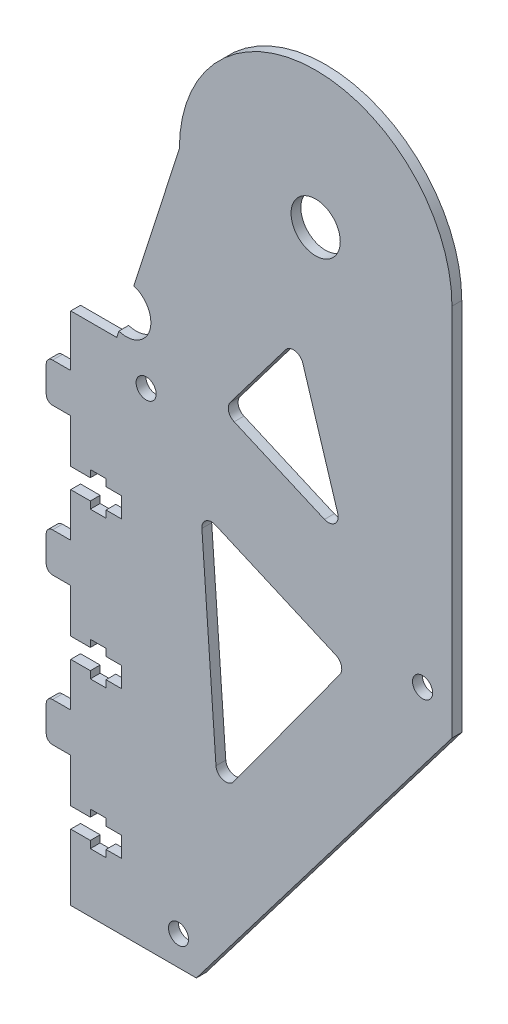
from build123d import *

# Parameters (mm, degrees)
SKETCH_1_R          = 5.0225
SKETCH_1_R_2        = 2.05
EXTRUDE_1_DEPTH     = 2
FILLET_1_R          = 2
FILLET_2_R          = 1.3
SKETCH_3_R          = 5
CUT_EXTRUDE_1_DEPTH = 2


with BuildPart() as part:
    # 草图1 → 凸台-拉伸1 (new body)
    with BuildSketch(Plane.XY):
        with BuildLine():
            Line((298.545628784, -83.894391363), (298.545628784, -92.841778663))
            Line((298.545628784, -92.841778663), (302.545628784, -92.841778663))
            Line((302.545628784, -92.841778663), (302.545628784, -91.391778663))
            Line((302.545628784, -91.391778663), (305.745628784, -91.391778663))
            Line((305.745628784, -91.391778663), (305.745628784, -92.841778663))
            Line((305.745628784, -92.841778663), (308.945628784, -92.841778663))
            Line((308.945628784, -92.841778663), (308.945628784, -96.941778663))
            Line((308.945628784, -96.941778663), (305.745628784, -96.941778663))
            Line((305.745628784, -96.941778663), (305.745628784, -98.391778663))
            Line((305.745628784, -98.391778663), (302.545628784, -98.391778663))
            Line((302.545628784, -98.391778663), (302.545628784, -96.941778663))
            Line((302.545628784, -96.941778663), (298.545628784, -96.941778663))
            Line((298.545628784, -96.941778663), (298.545628784, -105.894391358))
            Line((298.545628784, -105.894391358), (293.545628784, -105.894391358))
            Line((293.545628784, -105.894391358), (293.545628784, -113.894391358))
            Line((293.545628784, -113.894391358), (298.545628784, -113.894391358))
            Line((298.545628784, -113.894391358), (298.545628784, -122.847004054))
            Line((298.545628784, -122.847004054), (302.545628784, -122.847004054))
            Line((302.545628784, -122.847004054), (302.545628784, -121.397004054))
            Line((302.545628784, -121.397004054), (305.745628784, -121.397004054))
            Line((305.745628784, -121.397004054), (305.745628784, -122.847004054))
            Line((305.745628784, -122.847004054), (308.945628784, -122.847004054))
            Line((308.945628784, -122.847004054), (308.945628784, -126.947004054))
            Line((308.945628784, -126.947004054), (305.745628784, -126.947004054))
            Line((305.745628784, -126.947004054), (305.745628784, -128.397004054))
            Line((305.745628784, -128.397004054), (302.545628784, -128.397004054))
            Line((302.545628784, -128.397004054), (302.545628784, -126.947004054))
            Line((302.545628784, -126.947004054), (298.545628784, -126.947004054))
            Line((298.545628784, -126.947004054), (298.545628784, -140.447004054))
            Line((298.545628784, -140.447004054), (324.188862368, -140.447004054))
            Line((324.188862368, -140.447004054), (376.358604426, -71.946984141))
            Line((376.358604426, -71.946984141), (376.358604426, 4.396201153))
            ThreePointArc((376.358604426, 4.396201153), (348.536987634, 32.217817945), (320.715370843, 4.396201153))
            Line((320.715370843, 4.396201153), (307.936987634, -35.346984141))
            Line((307.936987634, -35.346984141), (298.545628784, -35.346984141))
            Line((298.545628784, -35.346984141), (298.545628784, -45.889165972))
            Line((298.545628784, -45.889165972), (293.545628784, -45.889165972))
            Line((293.545628784, -45.889165972), (293.545628784, -53.889165972))
            Line((293.545628784, -53.889165972), (298.545628784, -53.889165972))
            Line((298.545628784, -53.889165972), (298.545628784, -62.841778668))
            Line((298.545628784, -62.841778668), (302.545628784, -62.841778668))
            Line((302.545628784, -62.841778668), (302.545628784, -61.391778668))
            Line((302.545628784, -61.391778668), (305.745628784, -61.391778668))
            Line((305.745628784, -61.391778668), (305.745628784, -62.841778668))
            Line((305.745628784, -62.841778668), (308.945628784, -62.841778668))
            Line((308.945628784, -62.841778668), (308.945628784, -66.941778668))
            Line((308.945628784, -66.941778668), (305.745628784, -66.941778668))
            Line((305.745628784, -66.941778668), (305.745628784, -68.391778668))
            Line((305.745628784, -68.391778668), (302.545628784, -68.391778668))
            Line((302.545628784, -68.391778668), (302.545628784, -66.941778668))
            Line((302.545628784, -66.941778668), (298.545628784, -66.941778668))
            Line((298.545628784, -66.941778668), (298.545628784, -75.894391363))
            Line((298.545628784, -75.894391363), (293.545628784, -75.894391363))
            Line((293.545628784, -75.894391363), (293.545628784, -83.894391363))
            Line((293.545628784, -83.894391363), (298.545628784, -83.894391363))
        make_face()
        with Locations((348.536987634, 4.396201153)):
            Circle(SKETCH_1_R, mode=Mode.SUBTRACT)
        with Locations((320.545628784, -134.447004054)):
            Circle(SKETCH_1_R_2, mode=Mode.SUBTRACT)
        with Locations((370.358604426, -65.946984141)):
            Circle(SKETCH_1_R_2, mode=Mode.SUBTRACT)
        with Locations((313.936987634, -41.346984141)):
            Circle(SKETCH_1_R_2, mode=Mode.SUBTRACT)
        Polygon((354.947285032, -70.136765586), (328.579617375, -106.396108383), (325.08144343, -57.115165973), align=None, mode=Mode.SUBTRACT)
        Polygon((329.571126451, -37.254352656), (354.337315751, -48.052488042), (344.758747766, -17.175445836), align=None, mode=Mode.SUBTRACT)
    extrude(amount=EXTRUDE_1_DEPTH)

    # 圆角1
    fillet_1_edges = [part.edges().sort_by_distance(p)[0] for p in [
        (354.947285032, -70.136765586, 1),
        (325.08144343, -57.115165973, 1),
        (328.579617375, -106.396108383, 1),
        (344.758747766, -17.175445836, 1),
        (329.571126451, -37.254352656, 1),
        (354.337315751, -48.052488042, 1),
    ]]
    fillet(fillet_1_edges, radius=FILLET_1_R)

    # 圆角2
    fillet_2_edges = [part.edges().sort_by_distance(p)[0] for p in [
        (293.545628784, -113.894391358, 1),
        (293.545628784, -105.894391358, 1),
        (293.545628784, -83.894391363, 1),
        (293.545628784, -75.894391363, 1),
        (293.545628784, -53.889165972, 1),
        (293.545628784, -45.889165972, 1),
    ]]
    fillet(fillet_2_edges, radius=FILLET_2_R)

    # 草图3 → 切除-拉伸1 (cut)
    with BuildSketch(Plane(origin=(0, 0, 0), x_dir=(-1, 0, 0), z_dir=(0, 0, -1))):
        with Locations((-309.899887982, -29.241993317)):
            Circle(SKETCH_3_R)
    extrude(amount=-CUT_EXTRUDE_1_DEPTH, mode=Mode.SUBTRACT)


solid = part.part
